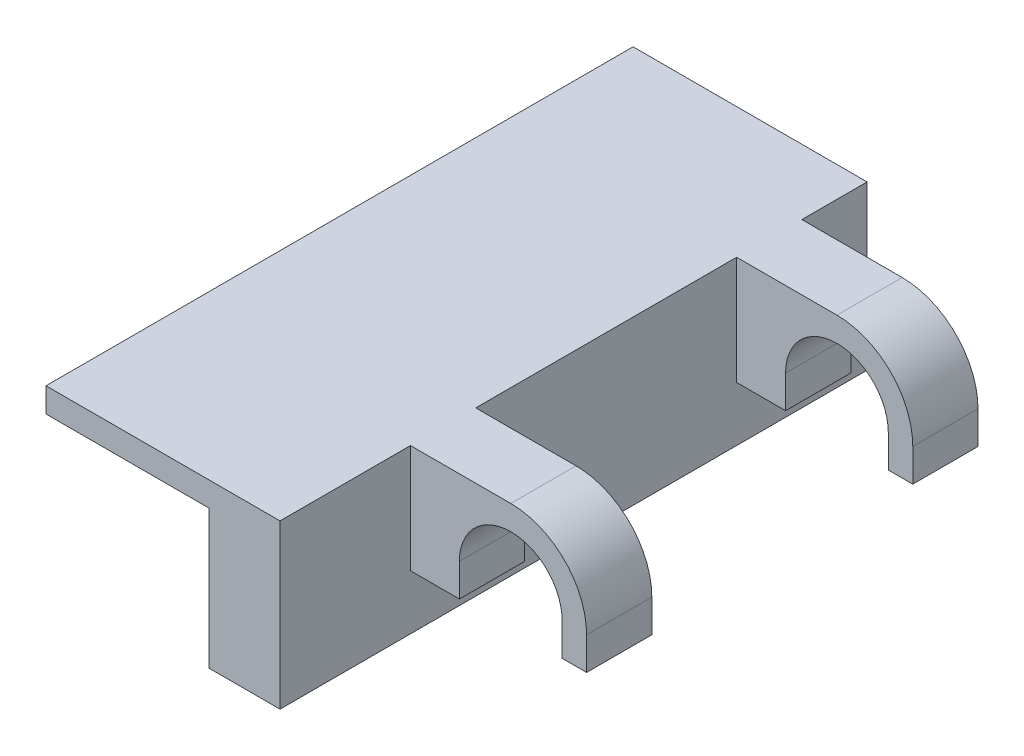
from build123d import *

# Parameters (mm, degrees)
AUFSATZ_LINEAR_AUSTRAGEN2_DEPTH = 18
SKIZZE3_W                       = 10.8
SKIZZE3_H                       = 4
SKIZZE3_H_2                     = 16
SKIZZE3_H_3                     = 8
SCHNITT_LINEAR_AUSTRAGEN1_DEPTH = 201.709049372
SCHNITT_LINEAR_AUSTRAGEN2_DEPTH = 203.940249827


with BuildPart() as part:
    # Skizze1 → Aufsatz-Linear austragen2 (new, symmetric)
    with BuildSketch(Plane.XY):
        with BuildLine():
            Line((-198.15, 0), (-198.15, -2))
            Line((-198.15, -2), (-199.65, -2))
            Line((-199.65, -2), (-199.65, 0))
            ThreePointArc((-199.65, 0), (-198.288046533, 3.288046533), (-195, 4.65))
            Line((-195, 4.65), (195, 4.65))
            ThreePointArc((195, 4.65), (198.288046533, 3.288046533), (199.65, 0))
            Line((199.65, 0), (199.65, -2))
            Line((199.65, -2), (198.15, -2))
            Line((198.15, -2), (198.15, 0))
            ThreePointArc((198.15, 0), (195, 3.15), (191.85, 0))
            Line((191.85, 0), (191.85, -2))
            Line((191.85, -2), (188.85, -2))
            Line((188.85, -2), (188.85, -5.35))
            Line((188.85, -5.35), (-188.85, -5.35))
            Line((-188.85, -5.35), (-188.85, -2))
            Line((-188.85, -2), (-191.85, -2))
            Line((-191.85, -2), (-191.85, 0))
            ThreePointArc((-191.85, 0), (-195, 3.15), (-198.15, 0))
        make_face()
    extrude(amount=AUFSATZ_LINEAR_AUSTRAGEN2_DEPTH, both=True)

    # Skizze3 → Schnitt-Linear austragen1 (cut, through all)
    with BuildSketch(Plane.XZ.offset(5.35)):
        with Locations((-194.25, 16)):
            Rectangle(SKIZZE3_W, SKIZZE3_H)
        with Locations((-194.25, 2)):
            Rectangle(SKIZZE3_W, SKIZZE3_H_2)
        with Locations((-194.25, -14)):
            Rectangle(SKIZZE3_W, SKIZZE3_H_3)
        with Locations((194.25, 14)):
            Rectangle(SKIZZE3_W, SKIZZE3_H_3)
        with Locations((194.25, -2)):
            Rectangle(SKIZZE3_W, SKIZZE3_H_2)
        with Locations((194.25, -16)):
            Rectangle(SKIZZE3_W, SKIZZE3_H)
    extrude(amount=-SCHNITT_LINEAR_AUSTRAGEN1_DEPTH, mode=Mode.SUBTRACT)

    # Skizze4 → Schnitt-Linear austragen2 (cut, through all)
    with BuildSketch(Plane.XY.offset(18)):
        Polygon((174.5, 4.65), (174.5, 3.15), (184.5, 3.15), (184.5, -5.35), (-199.65, -5.35), (-199.65, 4.65), align=None)
    extrude(amount=-SCHNITT_LINEAR_AUSTRAGEN2_DEPTH, mode=Mode.SUBTRACT)


solid = part.part
